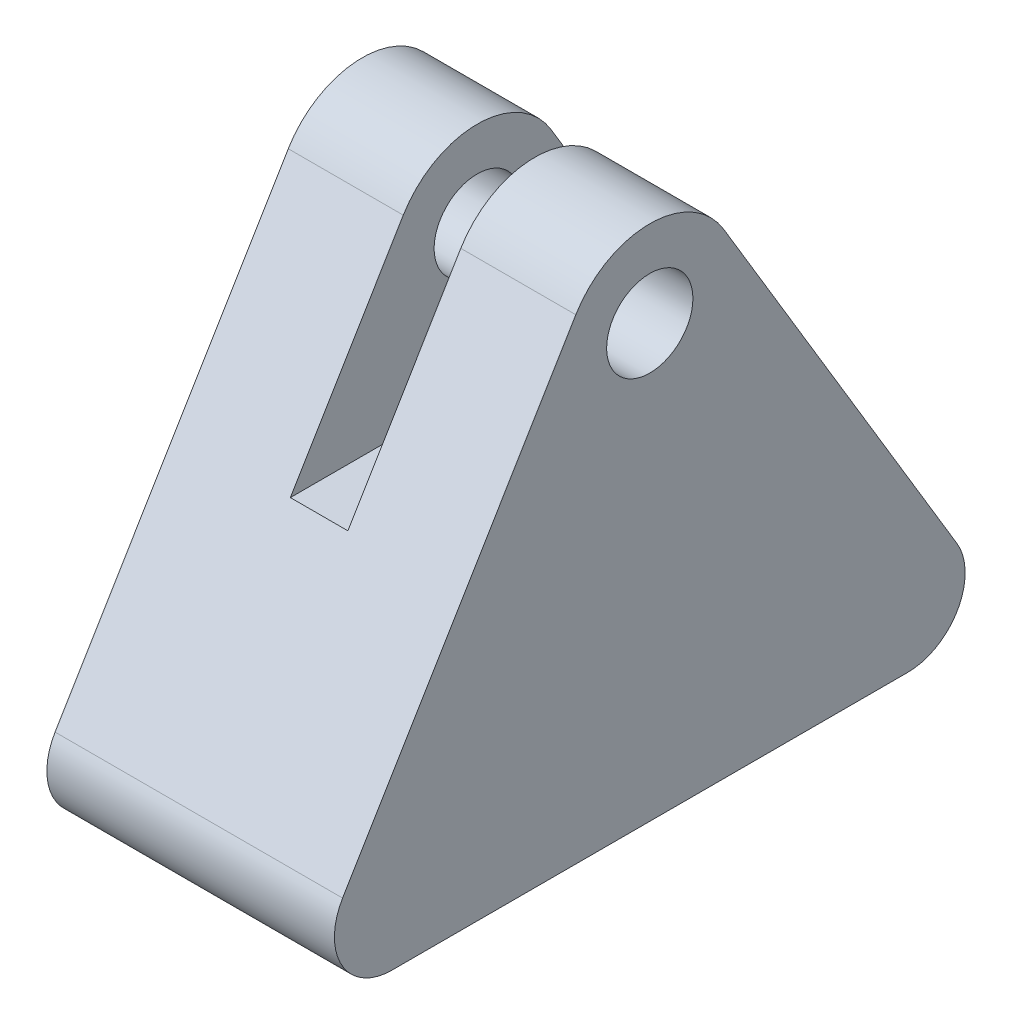
from build123d import *

# Parameters (mm, degrees)
ESQUISSE1_R                  = 1.5
BOSS_EXTRU_1_DEPTH           = 5
ENL_V_MAT_EXTRU_1_DEPTH      = 21.155644371
ENL_V_MAT_EXTRU_1_DEPTH_BACK = 21.155644371
ESQUISSE2_W                  = 2
ESQUISSE2_H                  = 8
CONG_1_R                     = 2


with BuildPart() as part:
    # Esquisse1 → Boss.-Extru.1 (new, symmetric)
    with BuildSketch(Plane(origin=(0, 0, 0), x_dir=(0, 0, -1), z_dir=(1, 0, 0))):
        with BuildLine():
            Line((2.572380753, 1.543650628), (12.5, -15))
            Line((12.5, -15), (-12.5, -15))
            Line((-12.5, -15), (-2.572380753, 1.543650628))
            ThreePointArc((-2.572380753, 1.543650628), (0, 3), (2.572380753, 1.543650628))
        make_face()
        Circle(ESQUISSE1_R, mode=Mode.SUBTRACT)
    extrude(amount=BOSS_EXTRU_1_DEPTH, both=True)

    # Esquisse2 → Enlèv. mat.-Extru.1 (cut, two sides: drawn at the far end of the back side and taken through both)
    with BuildSketch(Plane.XY.offset(-ENL_V_MAT_EXTRU_1_DEPTH_BACK)):
        with Locations((0, -1)):
            Rectangle(ESQUISSE2_W, ESQUISSE2_H)
    extrude(amount=ENL_V_MAT_EXTRU_1_DEPTH + ENL_V_MAT_EXTRU_1_DEPTH_BACK, mode=Mode.SUBTRACT)

    # Congé1
    cong_1_edges = [part.edges().sort_by_distance(p)[0] for p in [
        (0, -15, -12.5),
        (0, -15, 12.5),
    ]]
    fillet(cong_1_edges, radius=CONG_1_R)


solid = part.part
